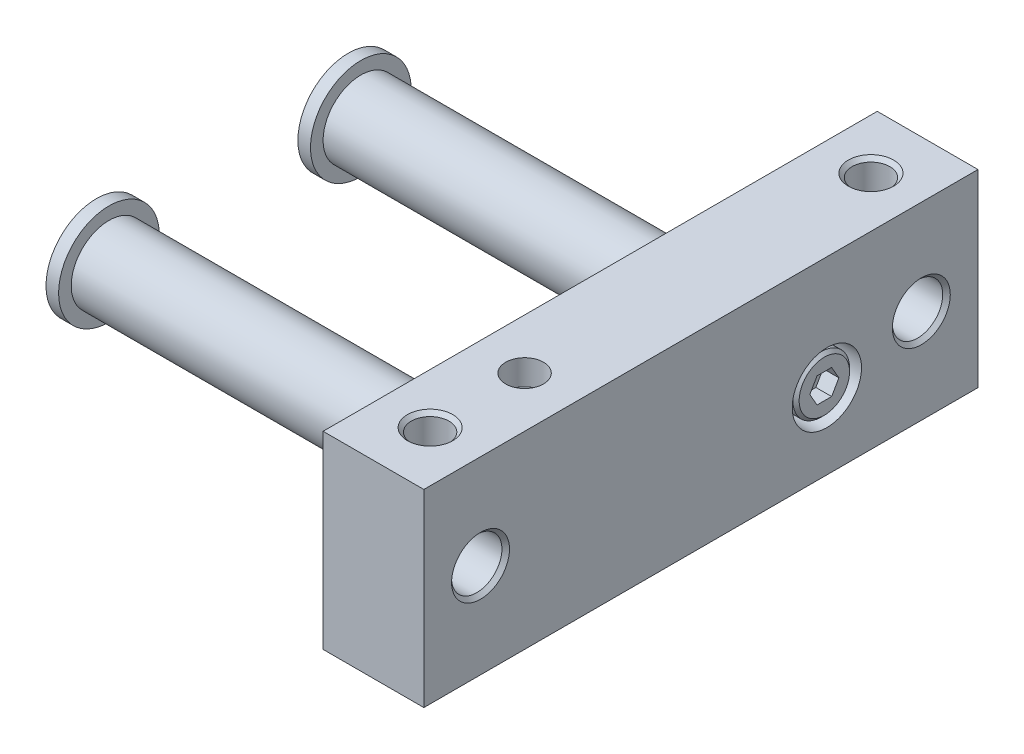
from build123d import *

# Parameters (mm, degrees)
PLATE_SKETCH_W               = 44
PLATE_SKETCH_H               = 15
PLATE_DEPTH                  = 8
TAPPED_HOLE_FACE_D           = 4
TAPPED_HOLE_FACE_CSINK_D     = 4.6
TAPPED_HOLE_FACE_CSINK_ANGLE = 90
RODS_DEPTH                   = 20
RODS_DEPTH_BACK              = 17
RODS_SKETCH_R                = 3
PISTON_SKETCH_R              = 4
PISTON_DEPTH                 = 1
TAPPED_HOLES_TOP_AT_2_COUNT  = 2
TAPPED_HOLES_TOP_AT_2_PITCH  = 35
SHCS_SEAT_SKETCH_R           = 2.75
SHCS_SEAT_DEPTH              = 2.7
SHCS_HEAD_SKETCH_R           = 2.25
SHCS_HEAD_DEPTH              = 2.5
SHCS_HEX_DEPTH               = 1.25
SHCS_CHAM_SIZE               = 0.25
SS_SEAT_SKETCH_R             = 1.5
SS_SEAT_DEPTH                = 2
SS_HEX_DEPTH                 = 1.25


with BuildPart() as part:
    # Plate_Sketch → Plate (new body)
    with BuildSketch(Plane(origin=(0, 0, 0), x_dir=(0, 0, -1), z_dir=(1, 0, 0))):
        Rectangle(PLATE_SKETCH_W, PLATE_SKETCH_H)
    extrude(amount=PLATE_DEPTH)

    # Tapped Hole Face (through all)
    with Locations(Plane(origin=(8, 0, 0), x_dir=(0, 0, -1), z_dir=(1, 0, 0))):
        with Locations((-17.5, 0), (17.5, 0)):
            CounterSinkHole(TAPPED_HOLE_FACE_D / 2, TAPPED_HOLE_FACE_CSINK_D / 2, counter_sink_angle=TAPPED_HOLE_FACE_CSINK_ANGLE)

    # Rods_Sketch → Rods (add, two sides: drawn at the far end of the back side and taken through both)
    with BuildSketch(Plane.ZY.offset(9).offset(-RODS_DEPTH_BACK)):
        with Locations((-10, -1.5)):
            Circle(RODS_SKETCH_R)
        with Locations(Location((10, -1.5, 0), (0, 0, 180))):
            Circle(RODS_SKETCH_R)
    extrude(amount=RODS_DEPTH + RODS_DEPTH_BACK)

    # Piston_Sketch → Piston (add)
    with BuildSketch(Plane.ZY.offset(29)):
        with Locations((-10, -1.5)):
            Circle(PISTON_SKETCH_R)
        with Locations((10, -1.5)):
            Circle(PISTON_SKETCH_R)
    extrude(amount=PISTON_DEPTH)

    # Tapped Holes Top Profile → Tapped Holes Top (revolve, cut)
    with BuildSketch(Plane(origin=(4, 7.5, -17.5), x_dir=(0, 0, 1), z_dir=(1, 0, 0))):
        Polygon((0, 0), (0, 5.420408726), (1.25, 5.2), (1.25, 5), (1.5, 5), (1.5, 0.3), (1.8, 0), align=None)
    tapped_holes_top = revolve(axis=Axis((4, 13.85, -17.5), (0, -1, 0)), mode=Mode.SUBTRACT)

    # Tapped Holes Top at 2: Tapped Holes Top ×2
    with Locations(*[(0, 0, i * TAPPED_HOLES_TOP_AT_2_PITCH) for i in range(1, TAPPED_HOLES_TOP_AT_2_COUNT)]):
        add(tapped_holes_top, mode=Mode.SUBTRACT)

    # Tapped Holes Top Mirror: Tapped Holes Top across plane
    add(tapped_holes_top.mirror(Plane.ZX), mode=Mode.SUBTRACT)

    # Tapped Holes Top Mirror copy 1 sketch → Tapped Holes Top Mirror copy 1 (revolve, cut)
    with BuildSketch(Plane(origin=(4, -7.5, 17.5), x_dir=(0, 0, 1), z_dir=(1, 0, 0))):
        Polygon((0, 0), (0, -5.420408726), (1.25, -5.2), (1.25, -5), (1.5, -5), (1.5, -0.3), (1.8, 0), align=None)
    revolve(axis=Axis((4, -13.85, 17.5), (0, -1, 0)), mode=Mode.SUBTRACT)

    # SHCS Seat_Sketch → SHCS Seat (cut)
    with BuildSketch(Plane(origin=(8, 0, 0), x_dir=(0, 0, -1), z_dir=(1, 0, 0))):
        with Locations((10, -1.5)):
            Circle(SHCS_SEAT_SKETCH_R)
    extrude(amount=-SHCS_SEAT_DEPTH, mode=Mode.SUBTRACT)

    # SHCS Head_Sketch → SHCS Head (add)
    with BuildSketch(Plane(origin=(5.3, 0, 0), x_dir=(0, 0, -1), z_dir=(1, 0, 0))):
        with Locations((10, -1.5)):
            Circle(SHCS_HEAD_SKETCH_R)
    extrude(amount=SHCS_HEAD_DEPTH)

    # SHCS Hex_Sketch → SHCS Hex (cut)
    with BuildSketch(Plane(origin=(7.8, 0, 0), x_dir=(0, 0, -1), z_dir=(1, 0, 0))):
        Polygon((10.577350269, -2.5), (11.154700538, -1.5), (10.577350269, -0.5), (9.422649731, -0.5), (8.845299462, -1.5), (9.422649731, -2.5), align=None)
    extrude(amount=-SHCS_HEX_DEPTH, mode=Mode.SUBTRACT)

    # SHCS Cham
    shcs_cham_edges = [part.edges().sort_by_distance(p)[0] for p in [
        (7.8, -1.5, -7.75),
    ]]
    chamfer(shcs_cham_edges, length=SHCS_CHAM_SIZE)

    # SS Seat_Sketch → SS Seat (cut)
    with BuildSketch(Plane(origin=(0, 7.5, 0), x_dir=(-1, 0, 0), z_dir=(0, 1, 0))):
        with Locations(Location((-4, 10, 0), (0, 0, 90))):
            Circle(SS_SEAT_SKETCH_R)
    extrude(amount=-SS_SEAT_DEPTH, mode=Mode.SUBTRACT)

    # SS Hex_Sketch → SS Hex (cut)
    with BuildSketch(Plane(origin=(0, 5.5, 0), x_dir=(-1, 0, 0), z_dir=(0, 1, 0))):
        Polygon((-4.75, 9.566987298), (-4, 9.133974596), (-3.25, 9.566987298), (-3.25, 10.433012702), (-4, 10.866025404), (-4.75, 10.433012702), align=None)
    extrude(amount=-SS_HEX_DEPTH, mode=Mode.SUBTRACT)


solid = part.part
